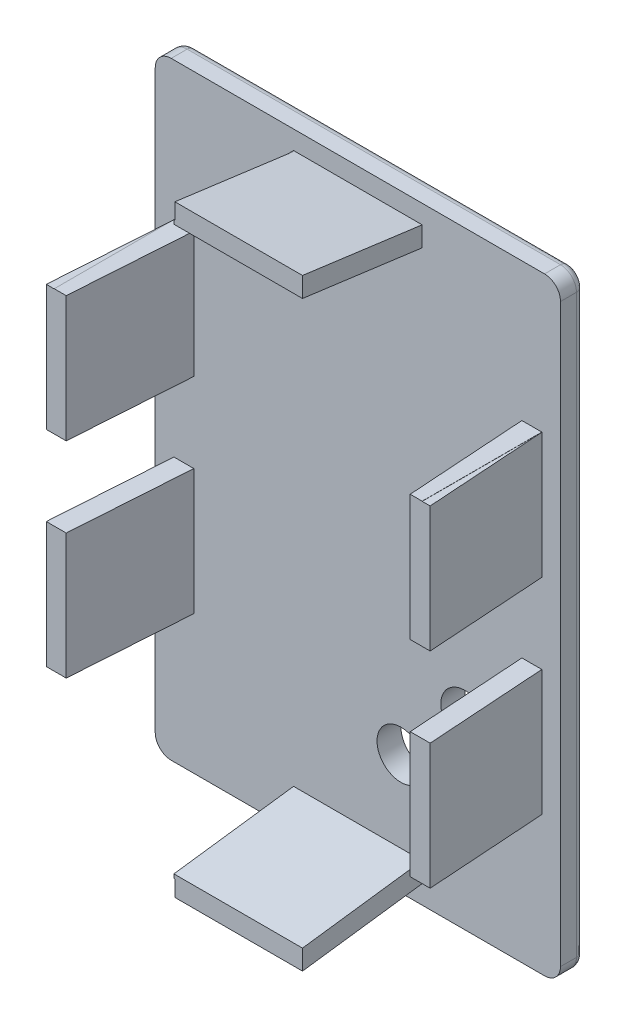
from build123d import *

# Parameters (mm, degrees)
CROQUIS1_W              = 50.8
CROQUIS1_H              = 76.2
SALIENTE_EXTRUIR1_DEPTH = 18
CROQUIS2_W              = 50.8
CROQUIS2_H              = 76.2
CROQUIS2_W_2            = 46.12
CROQUIS2_H_2            = 71.52
CROQUIS2_W_3            = 38.8
CROQUIS2_H_3            = 64.2
CORTAR_EXTRUIR1_DEPTH   = 15
CORTAR_EXTRUIR8_DEPTH   = 15
SALIENTE_EXTRUIR3_DEPTH = 41.5
CORTAR_EXTRUIR9_DEPTH   = 51.5
CORTAR_EXTRUIR10_DEPTH  = 51.5
SALIENTE_EXTRUIR4_DEPTH = 16
CORTAR_EXTRUIR11_DEPTH  = 16.5
REDONDEO3_R             = 2
REDONDEO4_R             = 1
CROQUIS15_W             = 48.12
CROQUIS15_H             = 10
CORTAR_EXTRUIR12_DEPTH  = 15
CROQUIS16_W             = 8
CROQUIS16_H             = 1.5
CORTAR_EXTRUIR13_DEPTH  = 2
CROQUIS17_R             = 3
CORTAR_EXTRUIR14_DEPTH  = 10


with BuildPart() as part:
    # Croquis1 → Saliente-Extruir1 (new body)
    with BuildSketch(Plane.XY):
        Rectangle(CROQUIS1_W, CROQUIS1_H)
    extrude(amount=SALIENTE_EXTRUIR1_DEPTH)

    # Croquis2 → Cortar-Extruir1 (cut)
    # profile 1 of 2: a face of its own
    with BuildSketch(Plane.XY.offset(18)):
        Rectangle(CROQUIS2_W, CROQUIS2_H)
        Rectangle(CROQUIS2_W_2, CROQUIS2_H_2, mode=Mode.SUBTRACT)
    # profile 2 of 2: a face of its own
    with BuildSketch(Plane.XY.offset(18)):
        Rectangle(CROQUIS2_W_3, CROQUIS2_H_3)
    extrude(amount=-CORTAR_EXTRUIR1_DEPTH, mode=Mode.SUBTRACT)

    # Croquis6 → Cortar-Extruir8 (cut)
    with BuildSketch(Plane.XY.offset(18)):
        Polygon((-23.06, 35.76), (-8.06, 35.76), (-8.06, 32.1), (-19.4, 32.1), (-19.4, 20.76), (-23.06, 20.76), align=None)
        Polygon((23.06, 35.76), (8.06, 35.76), (8.06, 32.1), (19.4, 32.1), (19.4, 20.76), (23.06, 20.76), align=None)
        Polygon((-23.06, -35.76), (-23.06, -20.76), (-19.4, -20.76), (-19.4, -32.1), (-8.06, -32.1), (-8.06, -35.76), align=None)
        Polygon((23.06, -35.76), (8.06, -35.76), (8.06, -32.1), (19.4, -32.1), (19.4, -20.76), (23.06, -20.76), align=None)
    extrude(amount=-CORTAR_EXTRUIR8_DEPTH, mode=Mode.SUBTRACT)

    # Croquis10 → Saliente-Extruir3 (add)
    with BuildSketch(Plane(origin=(0, -20.76, 0), x_dir=(-1, 0, 0), z_dir=(0, -1, 0))):
        Polygon((23.06, -18), (24.06, -18), (23.06, -3), align=None)
        Polygon((-23.06, -18), (-24.06, -18), (-23.06, -3), align=None)
    extrude(amount=-SALIENTE_EXTRUIR3_DEPTH)

    # Croquis11 → Cortar-Extruir9 (cut)
    with BuildSketch(Plane.XZ.offset(20.76)):
        Polygon((-19.4, 18), (-21.56, 18), (-20.56, 3), (-19.4, 3), align=None)
    extrude(amount=-CORTAR_EXTRUIR9_DEPTH, mode=Mode.SUBTRACT)

    # Croquis12 → Cortar-Extruir10 (cut)
    with BuildSketch(Plane.XZ.offset(20.76)):
        Polygon((19.4, 18), (19.4, 3), (20.56, 3), (21.56, 18), align=None)
    extrude(amount=-CORTAR_EXTRUIR10_DEPTH, mode=Mode.SUBTRACT)

    # Croquis13 → Saliente-Extruir4 (add)
    with BuildSketch(Plane(origin=(8.06, 0, 0), x_dir=(0, 0, -1), z_dir=(1, 0, 0))):
        Polygon((-18, -35.76), (-18, -37.76), (-3, -35.76), align=None)
        Polygon((-18, 35.76), (-18, 37.76), (-3, 35.76), align=None)
    extrude(amount=-SALIENTE_EXTRUIR4_DEPTH)

    # Croquis14 → Cortar-Extruir11 (cut)
    with BuildSketch(Plane(origin=(8.06, 0, 0), x_dir=(0, 0, -1), z_dir=(1, 0, 0))):
        Polygon((-3, -32.1), (-18, -32.1), (-18, -35.26), (-3, -33.26), align=None)
        Polygon((-18, 32.1), (-18, 35.26), (-3, 33.26), (-3, 32.1), align=None)
    extrude(amount=-CORTAR_EXTRUIR11_DEPTH, mode=Mode.SUBTRACT)

    # Redondeo3
    redondeo3_edges = [part.edges().sort_by_distance(p)[0] for p in [
        (-25.4, 38.1, 1.5),
        (25.4, 38.1, 1.5),
        (25.4, -38.1, 1.5),
        (-25.4, -38.1, 1.5),
    ]]
    fillet(redondeo3_edges, radius=REDONDEO3_R)

    # Redondeo4
    redondeo4_edges = [part.edges().sort_by_distance(p)[0] for p in [
        (0, 38.1, 0),
        (-25.4, 0, 0),
        (25.4, 0, 0),
        (0, -38.1, 0),
        (24.814213562, -37.514213562, 0),
        (-24.814213562, -37.514213562, 0),
        (-24.814213562, 37.514213562, 0),
        (24.814213562, 37.514213562, 0),
    ]]
    fillet(redondeo4_edges, radius=REDONDEO4_R)

    # Croquis15 → Cortar-Extruir12 (cut)
    with BuildSketch(Plane.XY.offset(18)):
        with Locations((0, -0.01)):
            Rectangle(CROQUIS15_W, CROQUIS15_H)
    extrude(amount=-CORTAR_EXTRUIR12_DEPTH, mode=Mode.SUBTRACT)

    # Croquis16 → Cortar-Extruir13 (cut)
    with BuildSketch(Plane.XZ.offset(38.1)):
        with Locations((0, 2.25)):
            Rectangle(CROQUIS16_W, CROQUIS16_H)
    extrude(amount=-CORTAR_EXTRUIR13_DEPTH, mode=Mode.SUBTRACT)

    # Croquis17 → Cortar-Extruir14 (cut)
    with BuildSketch(Plane.XY.offset(3)):
        with Locations((13.4, -23.1)):
            Circle(CROQUIS17_R)
        with Locations((13.4, -15.1)):
            Circle(CROQUIS17_R)
        with Locations((5.4, -23.1)):
            Circle(CROQUIS17_R)
    extrude(amount=-CORTAR_EXTRUIR14_DEPTH, mode=Mode.SUBTRACT)


solid = part.part
